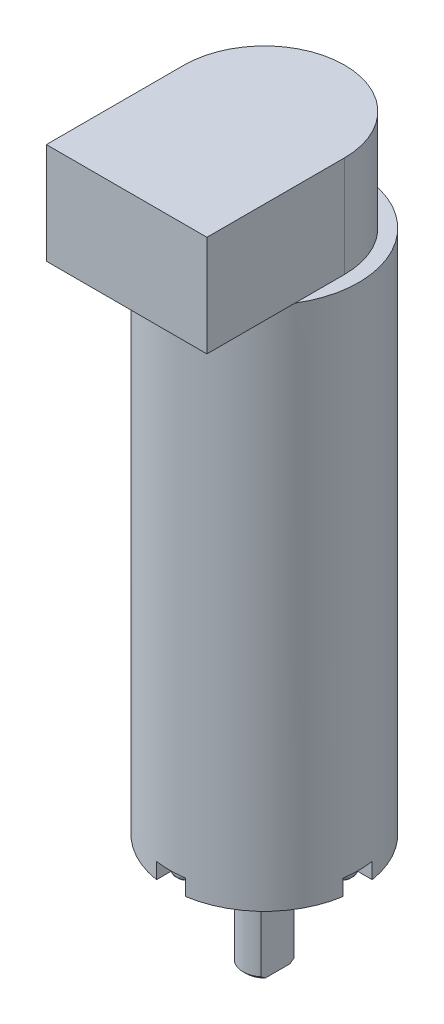
from build123d import *

# Parameters (mm, degrees)
SKETCH_1_R          = 17.75
EXTRUDE_1_DEPTH     = 62.86
EXTRUDE_START       = 35.9
SKETCH_2_R          = 17.75
EXTRUDE_3_DEPTH     = 35.9
SKETCH_4_R          = 11
EXTRUDE_4_DEPTH     = 2
SKETCH_5_R          = 4
EXTRUDE_5_DEPTH     = 19
CHAMFER_1_SIZE      = 0.6
CUT_EXTRUDE_1_DEPTH = 3
SKETCH_7_R          = 1.25
CUT_EXTRUDE_2_DEPTH = 4
SKETCH_8_R          = 2.25
EXTRUDE_6_DEPTH     = 2
FILLET_1_R          = 0.6
FILLET_2_R          = 0.6
FILLET_3_R          = 0.6
FILLET_4_R          = 0.6
CUT_EXTRUDE_3_DEPTH = 2
CUT_EXTRUDE_START   = -17
CUT_EXTRUDE_4_DEPTH = 17
EXTRUDE_7_DEPTH     = 19


with BuildPart() as part:
    # 草图1 → 凸台-拉伸1 (new body)
    with BuildSketch(Plane(origin=(0, 0, 0), x_dir=(1, 0, 0), z_dir=(0, 1, 0))):
        with Locations(Location((0, 0, 0), (0, 0, 270))):
            Circle(SKETCH_1_R)
    extrude(amount=EXTRUDE_1_DEPTH)

    # 草图2 → 凸台-拉伸3 (add)
    with BuildSketch(Plane.XZ.offset(EXTRUDE_START)):
        with Locations(Location((0, 0, 0), (0, 0, 270))):
            Circle(SKETCH_2_R)
    extrude(amount=-EXTRUDE_3_DEPTH)

    # 草图4 → 凸台-拉伸4 (add)
    with BuildSketch(Plane.XZ.offset(35.9)):
        with Locations(Location((0, 0, 0), (0, 0, 270))):
            Circle(SKETCH_4_R)
    extrude(amount=EXTRUDE_4_DEPTH)

    # 草图5 → 凸台-拉伸5 (add)
    with BuildSketch(Plane.XZ.offset(37.9)):
        with Locations(Location((0, 0, 0), (0, 0, 270))):
            Circle(SKETCH_5_R)
    extrude(amount=EXTRUDE_5_DEPTH)

    # 倒角1
    chamfer_1_edges = [part.edges().sort_by_distance(p)[0] for p in [
        (0, -56.9, 4),
    ]]
    chamfer(chamfer_1_edges, length=CHAMFER_1_SIZE)

    # 草图6 → 切除-拉伸1 (cut)
    with BuildSketch(Plane.XZ.offset(35.9)):
        with BuildLine():
            Line((-2.75, 14.395677917), (-2.75, 17.535677917))
            ThreePointArc((-2.75, 17.535677917), (0, 17.75), (2.75, 17.535677917))
            Line((2.75, 17.535677917), (2.75, 14.395677917))
            ThreePointArc((2.75, 14.395677917), (0, 11.645677917), (-2.75, 14.395677917))
        make_face()
        with BuildLine():
            Line((14.395677917, 2.75), (17.535677917, 2.75))
            ThreePointArc((17.535677917, 2.75), (17.75, 0), (17.535677917, -2.75))
            Line((17.535677917, -2.75), (14.395677917, -2.75))
            ThreePointArc((14.395677917, -2.75), (11.645677917, 0), (14.395677917, 2.75))
        make_face()
        with BuildLine():
            Line((2.75, -14.395677917), (2.75, -17.535677917))
            ThreePointArc((2.75, -17.535677917), (0, -17.75), (-2.75, -17.535677917))
            Line((-2.75, -17.535677917), (-2.75, -14.395677917))
            ThreePointArc((-2.75, -14.395677917), (0, -11.645677917), (2.75, -14.395677917))
        make_face()
        with BuildLine():
            Line((-14.395677917, -2.75), (-17.535677917, -2.75))
            ThreePointArc((-17.535677917, -2.75), (-17.75, 0), (-17.535677917, 2.75))
            Line((-17.535677917, 2.75), (-14.395677917, 2.75))
            ThreePointArc((-14.395677917, 2.75), (-11.645677917, 0), (-14.395677917, -2.75))
        make_face()
    extrude(amount=-CUT_EXTRUDE_1_DEPTH, mode=Mode.SUBTRACT)

    # 草图7 → 切除-拉伸2 (cut)
    with BuildSketch(Plane.XZ.offset(35.9)):
        with Locations(Location((-10.606601718, 10.606601718, 0), (0, 0, 270))):
            Circle(SKETCH_7_R)
        with Locations(Location((10.606601718, 10.606601718, 0), (0, 0, 270))):
            Circle(SKETCH_7_R)
        with Locations(Location((-10.606601718, -10.606601718, 0), (0, 0, 270))):
            Circle(SKETCH_7_R)
        with Locations(Location((10.606601718, -10.606601718, 0), (0, 0, 270))):
            Circle(SKETCH_7_R)
    extrude(amount=-CUT_EXTRUDE_2_DEPTH, mode=Mode.SUBTRACT)

    # 草图8 → 凸台-拉伸6 (add)
    with BuildSketch(Plane.XZ.offset(32.9)):
        with Locations(Location((0, 14.395677917, 0), (0, 0, 270))):
            Circle(SKETCH_8_R)
        with Locations(Location((-14.395677917, 0, 0), (0, 0, 270))):
            Circle(SKETCH_8_R)
        with Locations(Location((14.395677917, 0, 0), (0, 0, 270))):
            Circle(SKETCH_8_R)
        with Locations(Location((0, -14.395677917, 0), (0, 0, 270))):
            Circle(SKETCH_8_R)
    extrude(amount=EXTRUDE_6_DEPTH)

    # 圆角1
    fillet_1_edges = [part.edges().sort_by_distance(p)[0] for p in [
        (0, -34.9, 16.645677917),
    ]]
    fillet(fillet_1_edges, radius=FILLET_1_R)

    # 圆角2
    fillet_2_edges = [part.edges().sort_by_distance(p)[0] for p in [
        (-14.395677917, -34.9, 2.25),
    ]]
    fillet(fillet_2_edges, radius=FILLET_2_R)

    # 圆角3
    fillet_3_edges = [part.edges().sort_by_distance(p)[0] for p in [
        (0, -34.9, -12.145677917),
    ]]
    fillet(fillet_3_edges, radius=FILLET_3_R)

    # 圆角4
    fillet_4_edges = [part.edges().sort_by_distance(p)[0] for p in [
        (14.395677917, -34.9, 2.25),
    ]]
    fillet(fillet_4_edges, radius=FILLET_4_R)

    # 草图10 → 切除-拉伸3 (cut)
    with BuildSketch(Plane(origin=(0, -34.1, 0), x_dir=(-1, 0, 0), z_dir=(0, -1, 0))):
        with BuildLine():
            Line((0.3, -12.217014209), (0.3, -13.717014209))
            ThreePointArc((0.3, -13.717014209), (0.410908032, -13.984769884), (0.678663708, -14.095677917))
            Line((0.678663708, -14.095677917), (2.178663708, -14.095677917))
            ThreePointArc((2.178663708, -14.095677917), (2.199221579, -14.395677917), (2.178663708, -14.695677917))
            Line((2.178663708, -14.695677917), (0.678663708, -14.695677917))
            ThreePointArc((0.678663708, -14.695677917), (0.410908032, -14.806585949), (0.3, -15.074341625))
            Line((0.3, -15.074341625), (0.3, -16.574341625))
            ThreePointArc((0.3, -16.574341625), (0, -16.594899495), (-0.3, -16.574341625))
            Line((-0.3, -16.574341625), (-0.3, -15.074341625))
            ThreePointArc((-0.3, -15.074341625), (-0.410908032, -14.806585949), (-0.678663708, -14.695677917))
            Line((-0.678663708, -14.695677917), (-2.178663708, -14.695677917))
            ThreePointArc((-2.178663708, -14.695677917), (-2.199221579, -14.395677917), (-2.178663708, -14.095677917))
            Line((-2.178663708, -14.095677917), (-0.678663708, -14.095677917))
            ThreePointArc((-0.678663708, -14.095677917), (-0.410908032, -13.984769884), (-0.3, -13.717014209))
            Line((-0.3, -13.717014209), (-0.3, -12.217014209))
            ThreePointArc((-0.3, -12.217014209), (0, -12.196456338), (0.3, -12.217014209))
        make_face()
        with BuildLine():
            Line((-12.217014209, 0.3), (-13.717014209, 0.3))
            ThreePointArc((-13.717014209, 0.3), (-13.984769884, 0.410908032), (-14.095677917, 0.678663708))
            Line((-14.095677917, 0.678663708), (-14.095677917, 2.178663708))
            ThreePointArc((-14.095677917, 2.178663708), (-14.395677917, 2.199221579), (-14.695677917, 2.178663708))
            Line((-14.695677917, 2.178663708), (-14.695677917, 0.678663708))
            ThreePointArc((-14.695677917, 0.678663708), (-14.806585949, 0.410908032), (-15.074341625, 0.3))
            Line((-15.074341625, 0.3), (-16.574341625, 0.3))
            ThreePointArc((-16.574341625, 0.3), (-16.594899495, 0), (-16.574341625, -0.3))
            Line((-16.574341625, -0.3), (-15.074341625, -0.3))
            ThreePointArc((-15.074341625, -0.3), (-14.806585949, -0.410908032), (-14.695677917, -0.678663708))
            Line((-14.695677917, -0.678663708), (-14.695677917, -2.178663708))
            ThreePointArc((-14.695677917, -2.178663708), (-14.395677917, -2.199221579), (-14.095677917, -2.178663708))
            Line((-14.095677917, -2.178663708), (-14.095677917, -0.678663708))
            ThreePointArc((-14.095677917, -0.678663708), (-13.984769884, -0.410908032), (-13.717014209, -0.3))
            Line((-13.717014209, -0.3), (-12.217014209, -0.3))
            ThreePointArc((-12.217014209, -0.3), (-12.196456338, 0), (-12.217014209, 0.3))
        make_face()
        with BuildLine():
            Line((0.3, 12.217014209), (0.3, 13.717014209))
            ThreePointArc((0.3, 13.717014209), (0.410908032, 13.984769884), (0.678663708, 14.095677917))
            Line((0.678663708, 14.095677917), (2.178663708, 14.095677917))
            ThreePointArc((2.178663708, 14.095677917), (2.199221579, 14.395677917), (2.178663708, 14.695677917))
            Line((2.178663708, 14.695677917), (0.678663708, 14.695677917))
            ThreePointArc((0.678663708, 14.695677917), (0.410908032, 14.806585949), (0.3, 15.074341625))
            Line((0.3, 15.074341625), (0.3, 16.574341625))
            ThreePointArc((0.3, 16.574341625), (0, 16.594899495), (-0.3, 16.574341625))
            Line((-0.3, 16.574341625), (-0.3, 15.074341625))
            ThreePointArc((-0.3, 15.074341625), (-0.410908032, 14.806585949), (-0.678663708, 14.695677917))
            Line((-0.678663708, 14.695677917), (-2.178663708, 14.695677917))
            ThreePointArc((-2.178663708, 14.695677917), (-2.199221579, 14.395677917), (-2.178663708, 14.095677917))
            Line((-2.178663708, 14.095677917), (-0.678663708, 14.095677917))
            ThreePointArc((-0.678663708, 14.095677917), (-0.410908032, 13.984769884), (-0.3, 13.717014209))
            Line((-0.3, 13.717014209), (-0.3, 12.217014209))
            ThreePointArc((-0.3, 12.217014209), (0, 12.196456338), (0.3, 12.217014209))
        make_face()
        with BuildLine():
            Line((12.217014209, -0.3), (13.717014209, -0.3))
            ThreePointArc((13.717014209, -0.3), (13.984769884, -0.410908032), (14.095677917, -0.678663708))
            Line((14.095677917, -0.678663708), (14.095677917, -2.178663708))
            ThreePointArc((14.095677917, -2.178663708), (14.395677917, -2.199221579), (14.695677917, -2.178663708))
            Line((14.695677917, -2.178663708), (14.695677917, -0.678663708))
            ThreePointArc((14.695677917, -0.678663708), (14.806585949, -0.410908032), (15.074341625, -0.3))
            Line((15.074341625, -0.3), (16.574341625, -0.3))
            ThreePointArc((16.574341625, -0.3), (16.594899495, 0), (16.574341625, 0.3))
            Line((16.574341625, 0.3), (15.074341625, 0.3))
            ThreePointArc((15.074341625, 0.3), (14.806585949, 0.410908032), (14.695677917, 0.678663708))
            Line((14.695677917, 0.678663708), (14.695677917, 2.178663708))
            ThreePointArc((14.695677917, 2.178663708), (14.395677917, 2.199221579), (14.095677917, 2.178663708))
            Line((14.095677917, 2.178663708), (14.095677917, 0.678663708))
            ThreePointArc((14.095677917, 0.678663708), (13.984769884, 0.410908032), (13.717014209, 0.3))
            Line((13.717014209, 0.3), (12.217014209, 0.3))
            ThreePointArc((12.217014209, 0.3), (12.196456338, 0), (12.217014209, -0.3))
        make_face()
    extrude(amount=CUT_EXTRUDE_3_DEPTH, mode=Mode.SUBTRACT)

    # 草图11 → 切除-拉伸4 (cut)
    with BuildSketch(Plane.XZ.offset(56.9).offset(CUT_EXTRUDE_START)):
        with BuildLine():
            Line((2.5, 2.928640819), (2.5, -2.928640819))
            Line((2.5, -2.928640819), (2.5, -3.122498999))
            ThreePointArc((2.5, -3.122498999), (4, 0), (2.5, 3.122498999))
            Line((2.5, 3.122498999), (2.5, 2.928640819))
        make_face()
    extrude(amount=CUT_EXTRUDE_4_DEPTH, mode=Mode.SUBTRACT)

    # 草图12 → 凸台-拉伸7 (add)
    with BuildSketch(Plane(origin=(0, 62.86, 0), x_dir=(1, 0, 0), z_dir=(0, 1, 0))):
        with BuildLine():
            Line((-15.1, 0), (-15.1, -25.9))
            Line((-15.1, -25.9), (15.1, -25.9))
            Line((15.1, -25.9), (15.1, 0))
            ThreePointArc((15.1, 0), (0, 15.1), (-15.1, 0))
        make_face()
    extrude(amount=EXTRUDE_7_DEPTH)


solid = part.part
